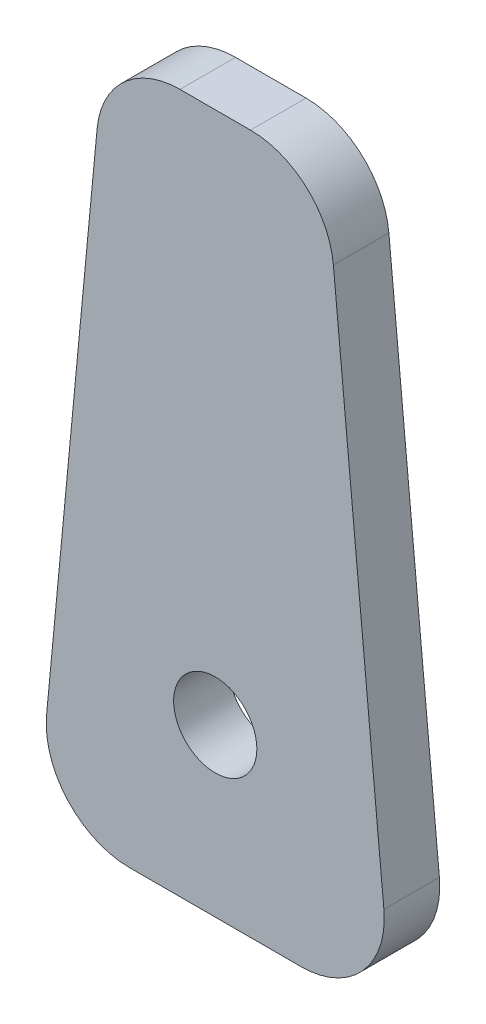
from build123d import *

# Parameters (mm, degrees)
SKETCH1_R           = 2.38125
BOSS_EXTRUDE1_DEPTH = 3.175


with BuildPart() as part:
    # Sketch1 → Boss-Extrude1 (new body)
    with BuildSketch(Plane.XY):
        with BuildLine():
            Line((33.461826777, 149.357099443), (30.571481949, 179.837099443))
            ThreePointArc((30.571481949, 179.837099443), (29.034950264, 182.910469174), (25.830251456, 184.15))
            Line((25.830251456, 184.15), (21.794748544, 184.15))
            ThreePointArc((21.794748544, 184.15), (18.590049736, 182.910469174), (17.053518051, 179.837099443))
            Line((17.053518051, 179.837099443), (14.163173223, 149.357099443))
            ThreePointArc((14.163173223, 149.357099443), (15.381434543, 145.702801192), (18.904403716, 144.145))
            Line((18.904403716, 144.145), (28.720596284, 144.145))
            ThreePointArc((28.720596284, 144.145), (32.243565457, 145.702801192), (33.461826777, 149.357099443))
        make_face()
        with Locations((23.8125, 153.67)):
            Circle(SKETCH1_R, mode=Mode.SUBTRACT)
    extrude(amount=BOSS_EXTRUDE1_DEPTH)


solid = part.part
